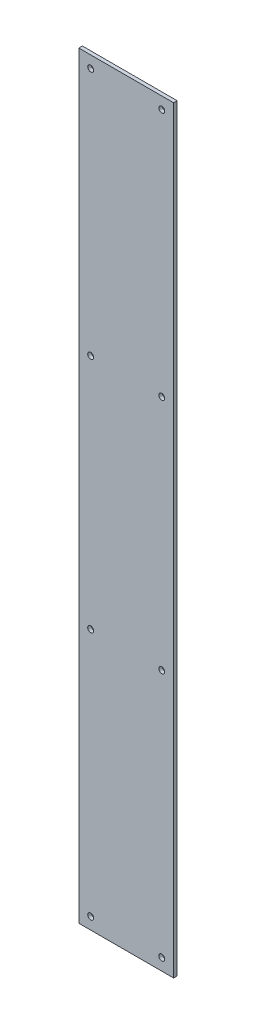
from build123d import *

# Parameters (mm, degrees)
SKETCH2_W           = 80
SKETCH2_H           = 640
BOSS_EXTRUDE1_DEPTH = 3
SKETCH3_R           = 2.5
CUT_EXTRUDE1_DEPTH  = 562.513012183


with BuildPart() as part:
    # Sketch2 → Boss-Extrude1 (new body)
    with BuildSketch(Plane.XY):
        with Locations((12.892561983, -239.008264463)):
            Rectangle(SKETCH2_W, SKETCH2_H)
    extrude(amount=BOSS_EXTRUDE1_DEPTH)

    # Sketch3 → Cut-Extrude1 (cut, through all)
    with BuildSketch(Plane.XY.offset(3)):
        with Locations((42.892561983, -549.008264463)):
            Circle(SKETCH3_R)
        with Locations((-17.107438017, -549.008264463)):
            Circle(SKETCH3_R)
        with Locations((-17.107438017, -339.008264463)):
            Circle(SKETCH3_R)
        with Locations((-17.107438017, 70.991735537)):
            Circle(SKETCH3_R)
        with Locations((-17.107438017, -139.008264463)):
            Circle(SKETCH3_R)
        with Locations((42.892561983, 70.991735537)):
            Circle(SKETCH3_R)
        with Locations((42.892561983, -139.008264463)):
            Circle(SKETCH3_R)
        with Locations((42.892561983, -339.008264463)):
            Circle(SKETCH3_R)
    extrude(amount=-CUT_EXTRUDE1_DEPTH, mode=Mode.SUBTRACT)


solid = part.part
